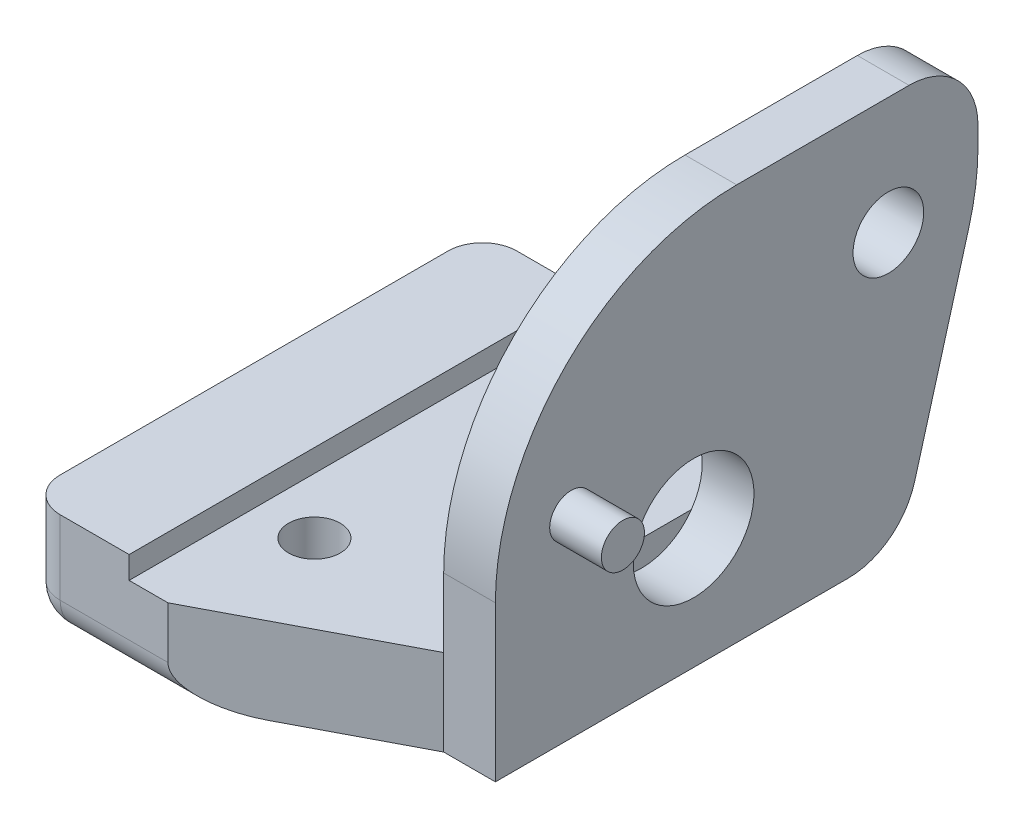
from build123d import *

# Parameters (mm, degrees)
EXTRUDE_1_DEPTH     = 5
SKETCH_2_W          = 28
SKETCH_2_H          = 23
EXTRUDE_2_DEPTH     = 3
SKETCH_3_R          = 1.5
CUT_EXTRUDE_1_DEPTH = 44.809958913
SKETCH_4_R          = 3.5
SKETCH_4_R_2        = 1.25
CUT_EXTRUDE_2_DEPTH = 43.400619099
FILLET_3_R          = 14
FILLET_4_R          = 2
SKETCH_6_W          = 6
SKETCH_6_H          = 26.5
EXTRUDE_3_DEPTH     = 1.3
FILLET_5_R          = 2
FILLET_6_R          = 2
SKETCH_7_R          = 1.25
EXTRUDE_4_DEPTH     = 6
SKETCH_8_W          = 11
SKETCH_8_H          = 3.2
EXTRUDE_5_DEPTH     = 3
SKETCH_10_R         = 2.05
CUT_EXTRUDE_3_DEPTH = 3
CUT_EXTRUDE_4_DEPTH = 3
FILLET_7_R          = 1
FILLET_8_R          = 2
FILLET_9_R          = 2
CUT_EXTRUDE_5_DEPTH = 10
FILLET_10_R         = 4


with BuildPart() as part:
    # 草图1 → 凸台-拉伸1 (new body)
    with BuildSketch(Plane(origin=(0, 0, 0), x_dir=(1, 0, 0), z_dir=(0, 1, 0))):
        Polygon((0, 0), (8.25, 0), (18.75, 5.5), (18.75, 26.5), (0, 26.5), align=None)
    extrude(amount=-EXTRUDE_1_DEPTH)

    # 草图2 → 凸台-拉伸2 (add)
    with BuildSketch(Plane(origin=(18.75, 0, 0), x_dir=(0, 0, -1), z_dir=(1, 0, 0))):
        with Locations((19.5, 6.5)):
            Rectangle(SKETCH_2_W, SKETCH_2_H)
    extrude(amount=EXTRUDE_2_DEPTH)

    # 草图3 → 切除-拉伸1 (cut, through all)
    with BuildSketch(Plane(origin=(0, 0, 0), x_dir=(1, 0, 0), z_dir=(0, 1, 0))):
        with Locations(Location((9.25, 22.5, 0), (0, 0, 270))):
            Circle(SKETCH_3_R)
        with Locations(Location((9.25, 7.5, 0), (0, 0, 270))):
            Circle(SKETCH_3_R)
    extrude(amount=-CUT_EXTRUDE_1_DEPTH, mode=Mode.SUBTRACT)

    # 草图4 → 切除-拉伸2 (cut, through all)
    with BuildSketch(Plane.ZY.offset(-18.75)):
        with Locations((-17, 2)):
            Circle(SKETCH_4_R)
        with Locations((-9.9, 6.2)):
            Circle(SKETCH_4_R_2)
    extrude(amount=-CUT_EXTRUDE_2_DEPTH, mode=Mode.SUBTRACT)

    # 圆角3
    fillet_3_edges = [part.edges().sort_by_distance(p)[0] for p in [
        (20.25, 18, -5.5),
    ]]
    fillet(fillet_3_edges, radius=FILLET_3_R)

    # 圆角4
    fillet_4_edges = [part.edges().sort_by_distance(p)[0] for p in [
        (9.375, -5, -26.5),
    ]]
    fillet(fillet_4_edges, radius=FILLET_4_R)

    # 草图6 → 凸台-拉伸3 (add)
    with BuildSketch(Plane(origin=(0, 0, 0), x_dir=(1, 0, 0), z_dir=(0, 1, 0))):
        with Locations((3, 13.25)):
            Rectangle(SKETCH_6_W, SKETCH_6_H)
    extrude(amount=EXTRUDE_3_DEPTH)

    # 圆角5
    fillet_5_edges = [part.edges().sort_by_distance(p)[0] for p in [
        (0, -1.85, 0),
    ]]
    fillet(fillet_5_edges, radius=FILLET_5_R)

    # 圆角6
    fillet_6_edges = [part.edges().sort_by_distance(p)[0] for p in [
        (0, -0.85, -26.5),
        (0, -5, -13.25),
        (0, -4.414213562, -25.914213562),
        (5.125, -5, 0),
        (0.585786438, -5, -0.585786438),
    ]]
    fillet(fillet_6_edges, radius=FILLET_6_R)

    # 草图7 → 凸台-拉伸4 (add)
    with BuildSketch(Plane.ZY.offset(-18.75)):
        with Locations((-9.9, 6.2)):
            Circle(SKETCH_7_R)
    extrude(amount=-EXTRUDE_4_DEPTH)

    # 草图8 → 凸台-拉伸5 (add)
    with BuildSketch(Plane.ZY.offset(-18.75)):
        with Locations((-28, 19.6)):
            Rectangle(SKETCH_8_W, SKETCH_8_H)
    extrude(amount=-EXTRUDE_5_DEPTH)

    # 草图10 → 切除-拉伸3 (cut)
    with BuildSketch(Plane.ZY.offset(-18.75)):
        with Locations((-28.3, 11.203029343)):
            Circle(SKETCH_10_R)
    extrude(amount=-CUT_EXTRUDE_3_DEPTH, mode=Mode.SUBTRACT)

    # 草图11 → 切除-拉伸4 (cut)
    with BuildSketch(Plane.ZY.offset(-18.75)):
        with BuildLine():
            Line((-32.977113162, 9.140846799), (-29.820411226, -2.082982308))
            ThreePointArc((-29.820411226, -2.082982308), (-28.385182257, -4.188410986), (-25.969807465, -5))
            Line((-25.969807465, -5), (-33.5, -5))
            Line((-33.5, -5), (-33.5, 12.931284876))
            ThreePointArc((-33.5, 12.931284876), (-33.368662233, 11.018117903), (-32.977113162, 9.140846799))
        make_face()
    extrude(amount=-CUT_EXTRUDE_4_DEPTH, mode=Mode.SUBTRACT)

    # 圆角7
    fillet_7_edges = [part.edges().sort_by_distance(p)[0] for p in [
        (20.25, 18, -22.5),
    ]]
    fillet(fillet_7_edges, radius=FILLET_7_R)

    # 圆角8
    fillet_8_edges = [part.edges().sort_by_distance(p)[0] for p in [
        (20.25, 21.2, -22.5),
    ]]
    fillet(fillet_8_edges, radius=FILLET_8_R)

    # 圆角9
    fillet_9_edges = [part.edges().sort_by_distance(p)[0] for p in [
        (20.25, 21.2, -33.5),
    ]]
    fillet(fillet_9_edges, radius=FILLET_9_R)

    # 草图12 → 切除-拉伸5 (cut)
    with BuildSketch(Plane.ZY.offset(-18.75)):
        Polygon((-21.5, 18), (-33.5, 18), (-36.951224722, 21.933704181), (-20.790244944, 21.933704181), align=None)
    extrude(amount=-CUT_EXTRUDE_5_DEPTH, mode=Mode.SUBTRACT)

    # 圆角10
    fillet_10_edges = [part.edges().sort_by_distance(p)[0] for p in [
        (20.25, 18, -33.5),
    ]]
    fillet(fillet_10_edges, radius=FILLET_10_R)


solid = part.part
